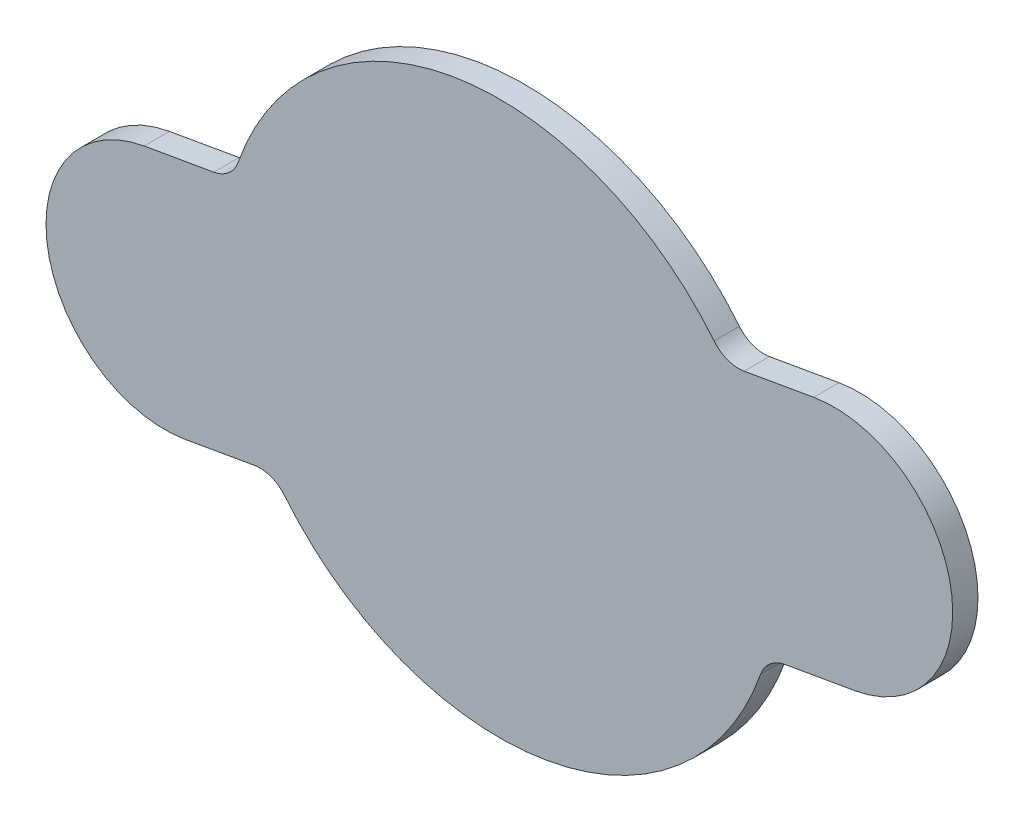
from build123d import *

# Parameters (mm, degrees)
BOSS_EXTRUDE1_DEPTH = 1.6


with BuildPart() as part:
    # Sketch1 → Boss-Extrude1 (new body)
    with BuildSketch(Plane.XY):
        with BuildLine():
            Line((-22.003509284, 5.033524036), (-17.599812346, 5.804133886))
            ThreePointArc((-17.599812346, 5.804133886), (-16.649697423, 6.249947352), (-16.056144074, 7.115489052))
            ThreePointArc((-16.056144074, 7.115489052), (-2.5490467, 18.589846752), (14.05191205, 12.384145126))
            ThreePointArc((14.05191205, 12.384145126), (14.904118282, 11.771599168), (15.949164479, 11.674922083))
            Line((15.949164479, 11.674922083), (20.352861417, 12.445531933))
            ThreePointArc((20.352861417, 12.445531933), (29.033392568, 6.350584932), (22.938445567, -2.329946219))
            Line((22.938445567, -2.329946219), (18.534748629, -3.100556069))
            ThreePointArc((18.534748629, -3.100556069), (17.584633707, -3.546369535), (16.991080357, -4.411911234))
            ThreePointArc((16.991080357, -4.411911234), (3.483982983, -15.886268935), (-13.116975767, -9.680567308))
            ThreePointArc((-13.116975767, -9.680567308), (-13.969181999, -9.068021351), (-15.014228195, -8.971344265))
            Line((-15.014228195, -8.971344265), (-19.417925134, -9.741954115))
            ThreePointArc((-19.417925134, -9.741954115), (-28.098456284, -3.647007115), (-22.003509284, 5.033524036))
        make_face()
    extrude(amount=BOSS_EXTRUDE1_DEPTH)


solid = part.part
